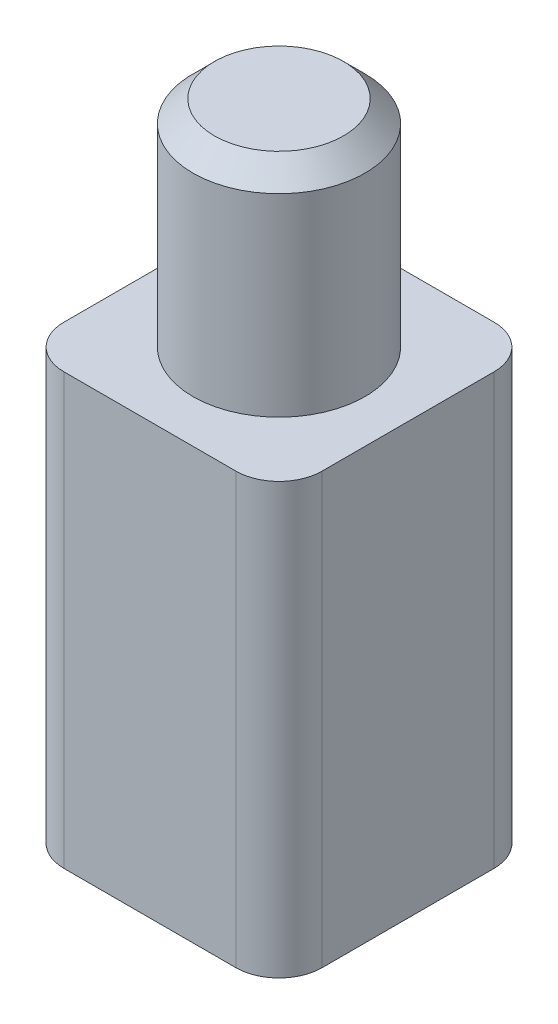
from build123d import *

# Parameters (mm, degrees)
SKETCH1_W           = 60
SKETCH1_H           = 60
BOSS_EXTRUDE1_DEPTH = 100
SKETCH2_R           = 20
BOSS_EXTRUDE2_DEPTH = 50
SKETCH3_W           = 30
SKETCH3_H           = 30
CUT_EXTRUDE1_DEPTH  = 30
SKETCH6_R           = 12.5
CUT_EXTRUDE7_DEPTH  = 40
FILLET1_R           = 10
FILLET2_R           = 10
CHAMFER1_SIZE       = 5
CHAMFER2_SIZE       = 5
CHAMFER2_SIZE2      = 2.886751346


with BuildPart() as part:
    # Sketch1 → Boss-Extrude1 (new body)
    with BuildSketch(Plane(origin=(0, 0, 0), x_dir=(1, 0, 0), z_dir=(0, 1, 0))):
        Rectangle(SKETCH1_W, SKETCH1_H)
    extrude(amount=BOSS_EXTRUDE1_DEPTH)

    # Sketch2 → Boss-Extrude2 (add)
    with BuildSketch(Plane(origin=(0, 100, 0), x_dir=(1, 0, 0), z_dir=(0, 1, 0))):
        with Locations(Location((0, 0, 0), (0, 0, 270))):
            Circle(SKETCH2_R)
    extrude(amount=BOSS_EXTRUDE2_DEPTH)

    # Sketch3 → Cut-Extrude1 (cut)
    with BuildSketch(Plane.XZ):
        with Locations((-0.219000236, 1.191138379)):
            Rectangle(SKETCH3_W, SKETCH3_H)
    extrude(amount=-CUT_EXTRUDE1_DEPTH, mode=Mode.SUBTRACT)

    # Sketch6 → Cut-Extrude7 (cut)
    with BuildSketch(Plane.XZ.offset(-30)):
        with Locations(Location((0, 0, 0), (0, 0, 270))):
            Circle(SKETCH6_R)
    extrude(amount=-CUT_EXTRUDE7_DEPTH, mode=Mode.SUBTRACT)

    # Fillet1
    fillet1_edges = [part.edges().sort_by_distance(p)[0] for p in [
        (-30, 50, -30),
        (-30, 50, 30),
        (30, 50, 30),
        (30, 50, -30),
    ]]
    fillet(fillet1_edges, radius=FILLET1_R)

    # Fillet2
    fillet2_edges = [part.edges().sort_by_distance(p)[0] for p in [
        (-15.219000236, 15, -13.808861621),
        (-15.219000236, 15, 16.191138379),
        (14.780999764, 15, 16.191138379),
        (14.780999764, 15, -13.808861621),
    ]]
    fillet(fillet2_edges, radius=FILLET2_R)

    # Chamfer1
    chamfer1_edges = [part.edges().sort_by_distance(p)[0] for p in [
        (0, 150, -20),
    ]]
    chamfer(chamfer1_edges, length=CHAMFER1_SIZE)

    # Chamfer2
    chamfer2_edges = [part.edges().sort_by_distance(p)[0] for p in [
        (0, 70, 12.5),
    ]]
    chamfer2_side = [part.faces().sort_by_distance(p)[0] for p in [
        (0, 50, 12.5),
    ]]
    chamfer(chamfer2_edges, length=CHAMFER2_SIZE, length2=CHAMFER2_SIZE2, reference=chamfer2_side[0])


solid = part.part
